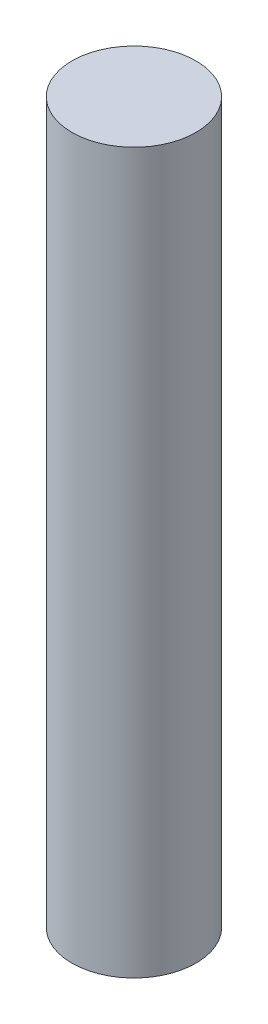
from build123d import *

# Parameters (mm, degrees)
SKETCH1_R           = 4.7625
BOSS_EXTRUDE1_DEPTH = 9.525
SKETCH2_R           = 4.7625
BOSS_EXTRUDE2_DEPTH = 45.72


with BuildPart() as part:
    # Sketch1 → Boss-Extrude1 (new body)
    with BuildSketch(Plane(origin=(0, 0, 0), x_dir=(1, 0, 0), z_dir=(0, 1, 0))):
        with Locations(Location((0, 0, 0), (0, 0, 270))):
            Circle(SKETCH1_R)
    extrude(amount=-BOSS_EXTRUDE1_DEPTH)

    # Sketch2 → Boss-Extrude2 (add)
    with BuildSketch(Plane(origin=(0, -9.525, 0), x_dir=(-1, 0, 0), z_dir=(0, -1, 0))):
        with Locations(Location((0, 0, 0), (0, 0, 270))):
            Circle(SKETCH2_R)
    extrude(amount=BOSS_EXTRUDE2_DEPTH)


solid = part.part
